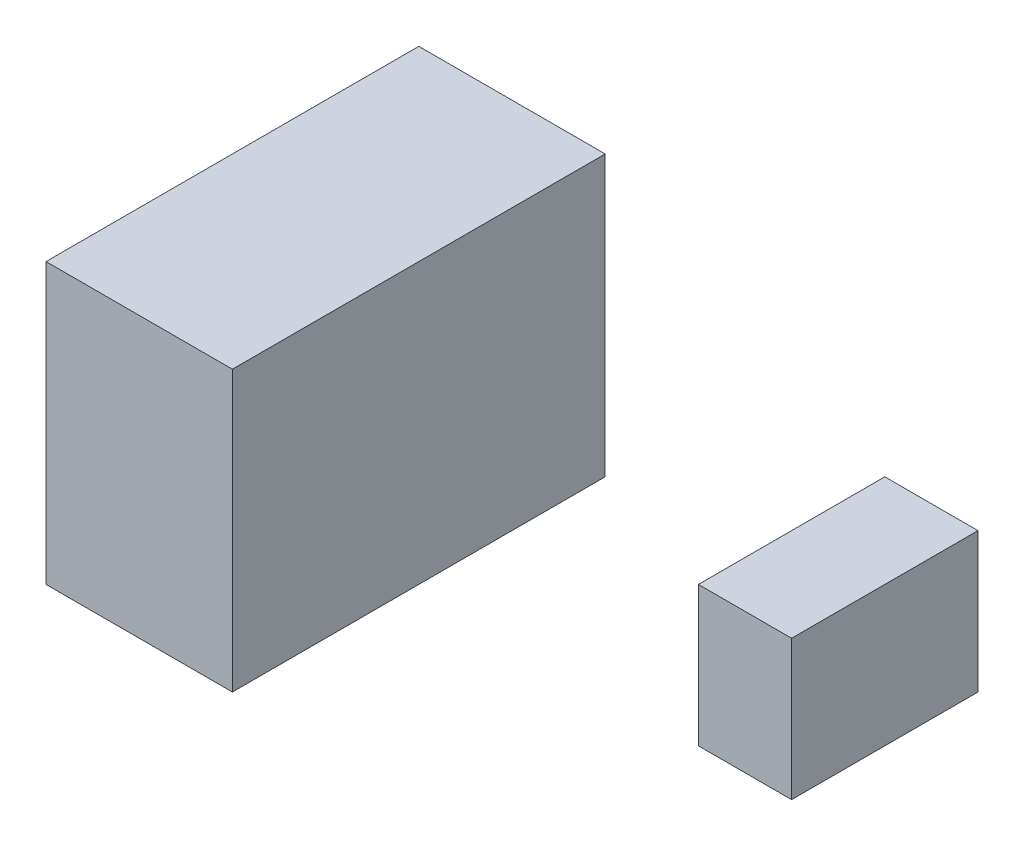
from build123d import *

# Parameters (mm, degrees)
SKETCH_LARGE_W      = 20
SKETCH_LARGE_H      = 30
FEATURE_LARGE_DEPTH = 40
SKETCH_SMALL_W      = 10
SKETCH_SMALL_H      = 15
FEATURE_SMALL_DEPTH = 20


with BuildPart() as part:
    # sketch:large → feature:large (new body)
    with BuildSketch(Plane.XY):
        with Locations((10, 15)):
            Rectangle(SKETCH_LARGE_W, SKETCH_LARGE_H)
    extrude(amount=FEATURE_LARGE_DEPTH)


with BuildPart() as body_2:
    # sketch:small → feature:small (new body)
    with BuildSketch(Plane.XY):
        with Locations((55, 7.5)):
            Rectangle(SKETCH_SMALL_W, SKETCH_SMALL_H)
    extrude(amount=FEATURE_SMALL_DEPTH)


solid = Compound([part.part, body_2.part])
